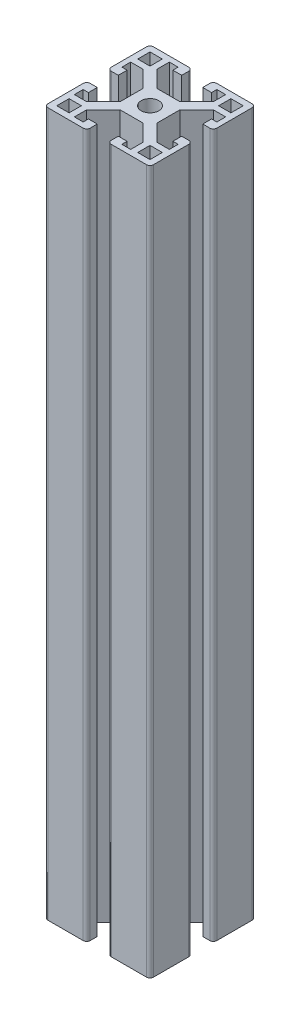
from build123d import *

# Parameters (mm, degrees)
SKETCH1_R           = 2.5
SKETCH1_W           = 3.5
SKETCH1_H           = 3.5
BOSS_EXTRUDE1_DEPTH = 200
FILLET1_R           = 1


with BuildPart() as part:
    # Sketch1 → Boss-Extrude1 (new body)
    with BuildSketch(Plane(origin=(0, 0, 0), x_dir=(1, 0, 0), z_dir=(0, 1, 0))):
        Polygon((-15, 7.5), (-15, -4.5), (-12, -4.5), (-12, -2), (-13.5, -2), (-13.5, 0.5), (-10, 0.5), (-5.25, -4.25), (-5.25, -10.75), (-10, -15.5), (-13.5, -15.5), (-13.5, -13), (-12, -13), (-12, -10.5), (-15, -10.5), (-15, -22.5), (-3, -22.5), (-3, -19.5), (-5.5, -19.5), (-5.5, -21), (-8, -21), (-8, -17.5), (-3.25, -12.75), (3.25, -12.75), (8, -17.5), (8, -21), (5.5, -21), (5.5, -19.5), (3, -19.5), (3, -22.5), (15, -22.5), (15, -10.5), (12, -10.5), (12, -13), (13.5, -13), (13.5, -15.5), (10, -15.5), (5.25, -10.75), (5.25, -4.25), (10, 0.5), (13.5, 0.5), (13.5, -2), (12, -2), (12, -4.5), (15, -4.5), (15, 7.5), (3, 7.5), (3, 4.5), (5.5, 4.5), (5.5, 6), (8, 6), (8, 2.5), (3.25, -2.25), (-3.25, -2.25), (-8, 2.5), (-8, 6), (-5.5, 6), (-5.5, 4.5), (-3, 4.5), (-3, 7.5), align=None)
        with Locations(Location((0, -7.5, 0), (0, 0, 270))):
            Circle(SKETCH1_R, mode=Mode.SUBTRACT)
        with Locations((-11.5, 4)):
            Rectangle(SKETCH1_W, SKETCH1_H, mode=Mode.SUBTRACT)
        with Locations((11.5, 4)):
            Rectangle(SKETCH1_W, SKETCH1_H, mode=Mode.SUBTRACT)
        with Locations((11.5, -19)):
            Rectangle(SKETCH1_W, SKETCH1_H, mode=Mode.SUBTRACT)
        with Locations((-11.5, -19)):
            Rectangle(SKETCH1_W, SKETCH1_H, mode=Mode.SUBTRACT)
    extrude(amount=-BOSS_EXTRUDE1_DEPTH)

    # Fillet1
    fillet1_edges = [part.edges().sort_by_distance(p)[0] for p in [
        (15, -100, 10.5),
        (15, -100, 22.5),
        (3, -100, 22.5),
        (-3, -100, 22.5),
        (-15, -100, 22.5),
        (-15, -100, 10.5),
        (-15, -100, 4.5),
        (-15, -100, -7.5),
        (-3, -100, -7.5),
        (3, -100, -7.5),
        (15, -100, -7.5),
        (15, -100, 4.5),
    ]]
    fillet(fillet1_edges, radius=FILLET1_R)


solid = part.part
